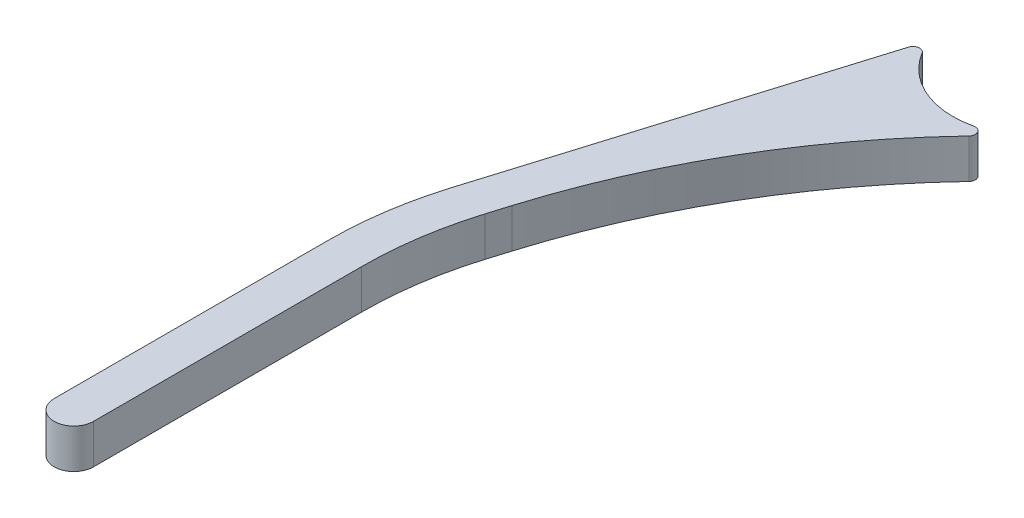
from build123d import *

# Parameters (mm, degrees)
BOSS_EXTRUDE1_DEPTH              = 19.05
F_1_8_0_125_DIAMETER_HOLE1_D     = 3.175
F_1_8_0_125_DIAMETER_HOLE1_DEPTH = 11.1252
F_1_8_0_125_DIAMETER_HOLE1_TIP   = 0.953866233


with BuildPart() as part:
    # Sketch1 → Boss-Extrude1 (new body)
    with BuildSketch(Plane(origin=(0, 0, 0), x_dir=(1, 0, 0), z_dir=(0, 1, 0))):
        with BuildLine():
            Line((-99.020583087, -242.427582229), (-99.020583087, -374.65))
            ThreePointArc((-99.020583087, -374.65), (-89.495583087, -384.175), (-79.970583087, -374.65))
            Line((-79.970583087, -374.65), (-79.970583087, -245.266880288))
            ThreePointArc((-79.970583087, -245.266880288), (-78.028039526, -219.05629054), (-72.242855135, -193.418425341))
            Line((-72.242855135, -193.418425341), (-69.161727013, -183.311770075))
            ThreePointArc((-69.161727013, -183.311770075), (-36.664014716, -108.894116093), (12.050429612, -43.924958467))
            ThreePointArc((12.050429612, -43.924958467), (12.501856954, -40.160483954), (9.02530478, -38.647658789))
            ThreePointArc((9.02530478, -38.647658789), (-15.385960803, -36.583737732), (-33.934614128, -20.580078236))
            ThreePointArc((-33.934614128, -20.580078236), (-37.044039814, -19.076108136), (-39.686388117, -21.300619228))
            Line((-39.686388117, -21.300619228), (-91.292855135, -190.579127282))
            ThreePointArc((-91.292855135, -190.579127282), (-97.078039526, -216.216992482), (-99.020583087, -242.427582229))
        make_face()
    extrude(amount=BOSS_EXTRUDE1_DEPTH)

    # 1/8 (0.125) Diameter Hole1
    with Locations(Plane(origin=(0, 0, 0), x_dir=(-1, 0, 0), z_dir=(0, -1, 0))):
        with Locations((89.495583087, -358.775), (31.192579134, -50.114011233), (87.553039526, -217.636641511)):
            Hole(F_1_8_0_125_DIAMETER_HOLE1_D / 2, depth=F_1_8_0_125_DIAMETER_HOLE1_DEPTH)
            with Locations((0, 0, -(F_1_8_0_125_DIAMETER_HOLE1_DEPTH + F_1_8_0_125_DIAMETER_HOLE1_TIP / 2))):  # 118° drill point
                Cone(0, F_1_8_0_125_DIAMETER_HOLE1_D / 2, F_1_8_0_125_DIAMETER_HOLE1_TIP, mode=Mode.SUBTRACT)


solid = part.part
